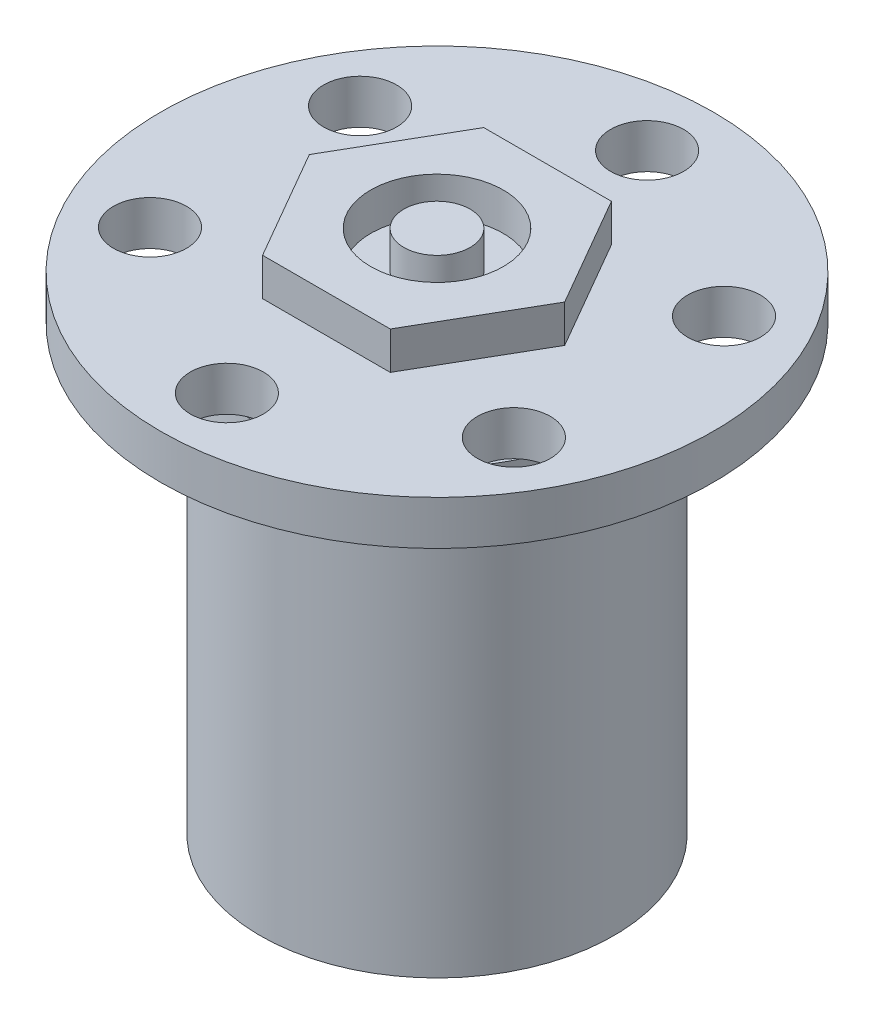
from build123d import *

# Parameters (mm, degrees)
SKETCH_1_R               = 12.5
EXTRUDE_1_DEPTH          = 2
SKETCH_2_R               = 1.65
CUT_EXTRUDE_1_DEPTH      = 18.790446875
PATTERN_CIRCULAR_1_COUNT = 6
SKETCH_3_R               = 8
EXTRUDE_2_DEPTH          = 20
EXTRUDE_3_DEPTH          = 1.7
SKETCH_5_R               = 3
SKETCH_5_R_2             = 1.5
CUT_EXTRUDE_2_DEPTH      = 1.7


with BuildPart() as part:
    # Эскиз1 → Бобышка-Вытянуть1 (new body)
    with BuildSketch(Plane(origin=(0, 0, 0), x_dir=(1, 0, 0), z_dir=(0, 1, 0))):
        with Locations(Location((0, 0, 0), (0, 0, 270))):
            Circle(SKETCH_1_R)
    extrude(amount=EXTRUDE_1_DEPTH)

    # Эскиз2 → Вырез-Вытянуть1 (cut, through all)
    with BuildSketch(Plane.XZ):
        with Locations(Location((0, -9.5, 0), (0, 0, 270))):
            Circle(SKETCH_2_R)
    cut_extrude_1 = extrude(amount=-CUT_EXTRUDE_1_DEPTH, mode=Mode.SUBTRACT)

    # Круговой массив1: Вырез-Вытянуть1 ×6 about axis
    pattern_circular_1_axis = Axis((0, 0, 0), (0, 1, 0))
    for i in range(1, PATTERN_CIRCULAR_1_COUNT):
        add(cut_extrude_1.rotate(pattern_circular_1_axis, i * 360 / PATTERN_CIRCULAR_1_COUNT), mode=Mode.SUBTRACT)

    # Эскиз3 → Бобышка-Вытянуть2 (add)
    with BuildSketch(Plane.XZ):
        with Locations(Location((0, 0, 0), (0, 0, 85.481135603))):
            Circle(SKETCH_3_R)
    extrude(amount=EXTRUDE_2_DEPTH)

    # Эскиз4 → Бобышка-Вытянуть3 (add)
    with BuildSketch(Plane(origin=(0, 2, 0), x_dir=(1, 0, 0), z_dir=(0, 1, 0))):
        Polygon((-5.773502692, 0), (-2.886751346, -5), (2.886751346, -5), (5.773502692, 0), (2.886751346, 5), (-2.886751346, 5), align=None)
    extrude(amount=EXTRUDE_3_DEPTH)

    # Эскиз5 → Вырез-Вытянуть2 (cut)
    with BuildSketch(Plane(origin=(0, 3.7, 0), x_dir=(1, 0, 0), z_dir=(0, 1, 0))):
        with Locations(Location((0, 0, 0), (0, 0, 270))):
            Circle(SKETCH_5_R)
        with Locations(Location((0, 0, 0), (0, 0, 270))):
            Circle(SKETCH_5_R_2, mode=Mode.SUBTRACT)
    extrude(amount=-CUT_EXTRUDE_2_DEPTH, mode=Mode.SUBTRACT)


solid = part.part
